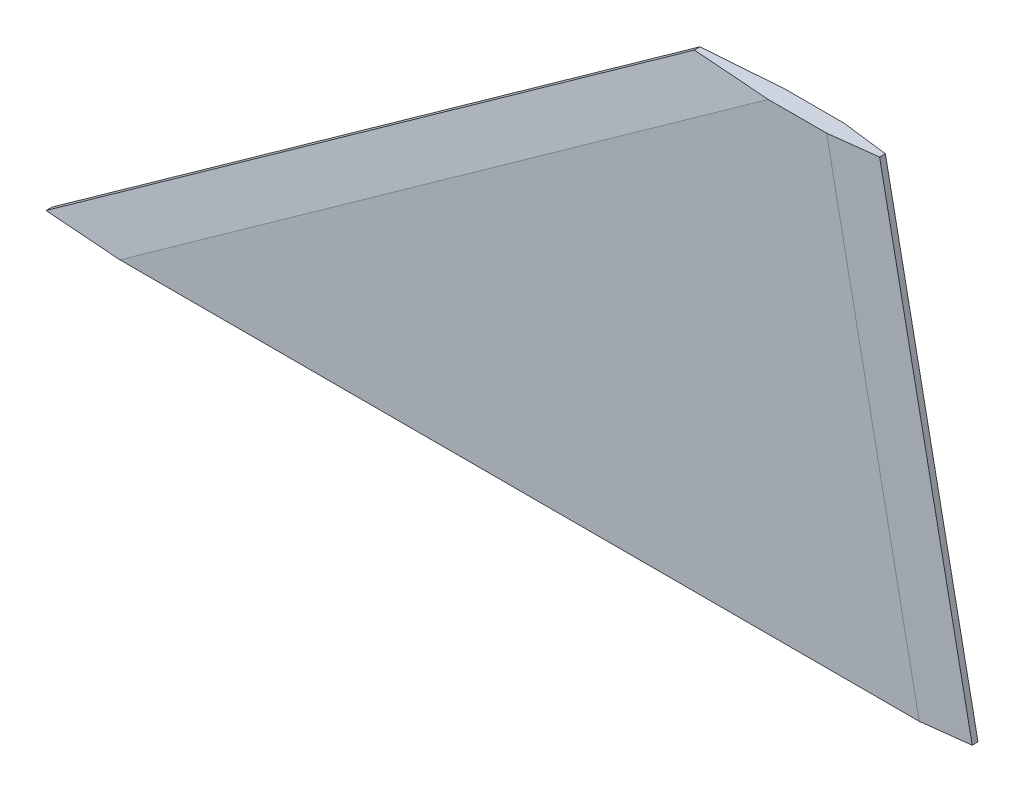
from build123d import *

# Parameters (mm, degrees)
BOSS_EXTRUDE1_DEPTH = 4.7625
CHAMFER1_SIZE       = 1.5875
CHAMFER1_SIZE2      = 12.7
CHAMFER2_SIZE       = 1.5875
CHAMFER2_SIZE2      = 12.7


with BuildPart() as part:
    # Sketch1 → Boss-Extrude1 (new body)
    with BuildSketch(Plane.XY):
        Polygon((0, 0), (254, 0), (228.6, 127), (177.8, 127), align=None)
    extrude(amount=BOSS_EXTRUDE1_DEPTH)

    # Chamfer1
    chamfer1_edges = [part.edges().sort_by_distance(p)[0] for p in [
        (88.9, 63.5, 4.7625),
        (88.9, 63.5, 0),
    ]]
    chamfer1_side = [part.faces().sort_by_distance(p)[0] for p in [
        (88.9, 63.5, 2.38125),
    ]]
    chamfer(chamfer1_edges, length=CHAMFER1_SIZE, length2=CHAMFER1_SIZE2, reference=chamfer1_side[0])

    # Chamfer2
    chamfer2_edges = [part.edges().sort_by_distance(p)[0] for p in [
        (241.3, 63.5, 4.7625),
        (241.3, 63.5, 0),
    ]]
    chamfer2_side = [part.faces().sort_by_distance(p)[0] for p in [
        (241.3, 63.5, 2.38125),
    ]]
    chamfer(chamfer2_edges, length=CHAMFER2_SIZE, length2=CHAMFER2_SIZE2, reference=chamfer2_side[0])


solid = part.part
